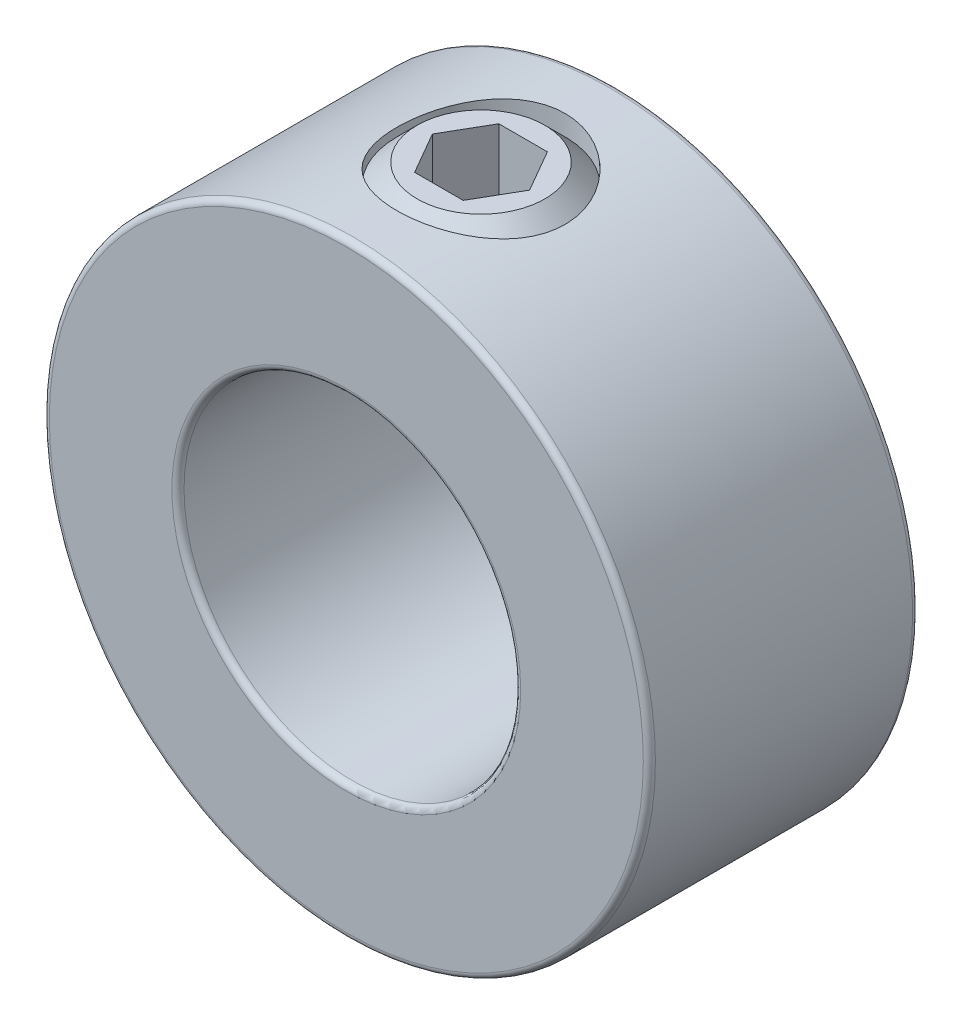
from build123d import *

# Parameters (mm, degrees)
SKETCH1_R          = 14.2875
SKETCH1_R_2        = 7.9375
EXTRUDE1_DEPTH     = 6.35
SKETCH2_R          = 3.96875
CUT_EXTRUDE1_DEPTH = 58.720417207
FILLET1_R          = 0.28575
CUT_EXTRUDE2_DEPTH = 3.96875


with BuildPart() as part:
    # Sketch1 → Extrude1 (new, symmetric)
    with BuildSketch(Plane.XY):
        Circle(SKETCH1_R)
        Circle(SKETCH1_R_2, mode=Mode.SUBTRACT)
    extrude(amount=EXTRUDE1_DEPTH, both=True)

    # Sketch2 → Cut-Extrude1 (cut, through all)
    with BuildSketch(Plane(origin=(41.275, 0, 0), x_dir=(0, 0, -1), z_dir=(0, -1, 0))):
        with Locations((0, -41.275)):
            Circle(SKETCH2_R)
    extrude(amount=-CUT_EXTRUDE1_DEPTH, mode=Mode.SUBTRACT)

    # Fillet1
    fillet1_edges = [part.edges().sort_by_distance(p)[0] for p in [
        (-14.2875, 0, -6.35),
        (-14.2875, 0, 6.35),
        (-7.9375, 0, -6.35),
        (-7.9375, 0, 6.35),
    ]]
    fillet(fillet1_edges, radius=FILLET1_R)


with BuildPart() as body_2:
    # Sketch3 → Revolve1 (revolve)
    with BuildSketch(Plane.XY):
        Polygon((-3.010240789, 7.9375), (-1.150211053, 7.9375), (0, 9.087711053), (0, 14.2875), (-3.010240789, 14.2875), (-3.96875, 13.328990789), (-3.96875, 8.896009211), align=None)
    revolve(axis=Axis((0, 7.9375, 0), (0, -1, 0)))

    # Sketch4 → Cut-Extrude2 (cut)
    with BuildSketch(Plane(origin=(3.3734375, 14.2875, 0), x_dir=(0, 0, -1), z_dir=(0, -1, 0))):
        Polygon((0, -1.082078619), (-1.984375, -2.22775806), (-1.984375, -4.51911694), (0, -5.664796381), (1.984375, -4.51911694), (1.984375, -2.22775806), align=None)
    extrude(amount=CUT_EXTRUDE2_DEPTH, mode=Mode.SUBTRACT)


solid = Compound([part.part, body_2.part])
